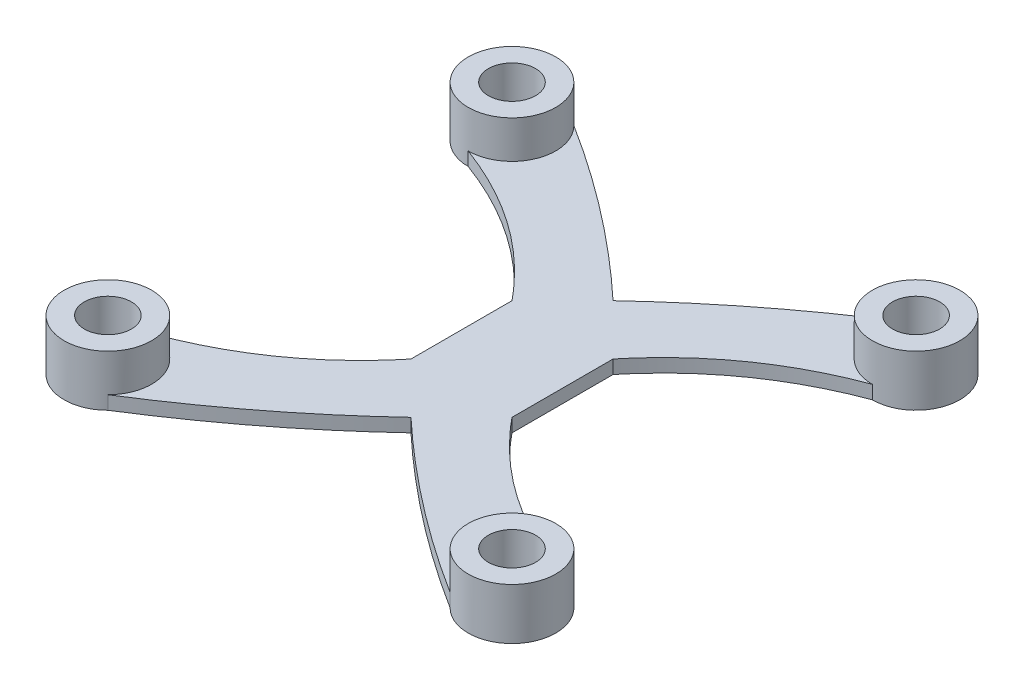
from build123d import *

# Parameters (mm, degrees)
SKETCH1_R           = 3.25
SKETCH1_R_2         = 1.75
SKETCH1_W           = 7.5
SKETCH1_H           = 7.5
BOSS_EXTRUDE1_DEPTH = 1
SKETCH2_R           = 3.25
SKETCH2_R_2         = 1.75
BOSS_EXTRUDE2_DEPTH = 2.8


with BuildPart() as part:
    # Sketch1 → Boss-Extrude1 (new body)
    # profile 1 of 11: a face of its own
    with BuildSketch(Plane(origin=(0, 0, 0), x_dir=(1, 0, 0), z_dir=(0, 1, 0))):
        with Locations((-15, -15)):
            Circle(SKETCH1_R)
        with Locations(Location((-15, -15, 0), (0, 0, 270))):
            Circle(SKETCH1_R_2, mode=Mode.SUBTRACT)
    # profile 2 of 11: a face of its own
    with BuildSketch(Plane(origin=(0, 0, 0), x_dir=(1, 0, 0), z_dir=(0, 1, 0))):
        with BuildLine():
            add(Edge.make_bspline(
                [(0, -7.5), (-1.930795648, -5.688459272), (-3.75, -3.75)],
                knots=[0.751545437, 0.751545437, 0.751545437, 1, 1, 1], degree=2))
            add(Edge.make_bspline(
                [(-15, -11.75), (-8.240801632, -9.240499337), (-3.75, -3.75)],
                knots=[0, 0, 0, 1, 1, 1], degree=2))
            ThreePointArc((-15, -11.75), (-12.701902961, -12.701902961), (-11.75, -15))
            ThreePointArc((-11.75, -15), (-11.997391519, -16.243721155), (-12.701902961, -17.298097039))
            add(Edge.make_bspline(
                [(-12.701902961, -17.298097039), (-5.840426668, -12.979694751), (0, -7.5)],
                knots=[0, 0, 0, 0.751545437, 0.751545437, 0.751545437], degree=2))
        make_face()
    # profile 3 of 11: a face of its own
    with BuildSketch(Plane(origin=(0, 0, 0), x_dir=(1, 0, 0), z_dir=(0, 1, 0))):
        with BuildLine():
            add(Edge.make_bspline(
                [(0, -7.5), (1.930795648, -5.688459272), (3.75, -3.75)],
                knots=[0.751545437, 0.751545437, 0.751545437, 1, 1, 1], degree=2))
            Line((3.75, -3.75), (-3.75, -3.75))
            add(Edge.make_bspline(
                [(0, -7.5), (-1.930795648, -5.688459272), (-3.75, -3.75)],
                knots=[0.751545437, 0.751545437, 0.751545437, 1, 1, 1], degree=2))
        make_face()
    # profile 4 of 11: a face of its own
    with BuildSketch(Plane(origin=(0, 0, 0), x_dir=(1, 0, 0), z_dir=(0, 1, 0))):
        Rectangle(SKETCH1_W, SKETCH1_H)
    # profile 5 of 11: a face of its own
    with BuildSketch(Plane(origin=(0, 0, 0), x_dir=(1, 0, 0), z_dir=(0, 1, 0))):
        with BuildLine():
            add(Edge.make_bspline(
                [(15, -11.75), (8.240801632, -9.240499337), (3.75, -3.75)],
                knots=[0, 0, 0, 1, 1, 1], degree=2))
            add(Edge.make_bspline(
                [(0, -7.5), (1.930795648, -5.688459272), (3.75, -3.75)],
                knots=[0.751545437, 0.751545437, 0.751545437, 1, 1, 1], degree=2))
            add(Edge.make_bspline(
                [(12.701902961, -17.298097039), (5.840426668, -12.979694751), (0, -7.5)],
                knots=[0, 0, 0, 0.751545437, 0.751545437, 0.751545437], degree=2))
            ThreePointArc((12.701902961, -17.298097039), (11.997391519, -13.756278845), (15, -11.75))
        make_face()
    # profile 6 of 11: a face of its own
    with BuildSketch(Plane(origin=(0, 0, 0), x_dir=(1, 0, 0), z_dir=(0, 1, 0))):
        with Locations((15, -15)):
            Circle(SKETCH1_R)
        with Locations(Location((15, -15, 0), (0, 0, 270))):
            Circle(SKETCH1_R_2, mode=Mode.SUBTRACT)
    # profile 7 of 11: a face of its own
    with BuildSketch(Plane(origin=(0, 0, 0), x_dir=(1, 0, 0), z_dir=(0, 1, 0))):
        with BuildLine():
            add(Edge.make_bspline(
                [(0, 7.5), (1.930795648, 5.688459272), (3.75, 3.75)],
                knots=[0.751545437, 0.751545437, 0.751545437, 1, 1, 1], degree=2))
            add(Edge.make_bspline(
                [(15, 11.75), (8.240801632, 9.240499337), (3.75, 3.75)],
                knots=[0, 0, 0, 1, 1, 1], degree=2))
            ThreePointArc((15, 11.75), (11.997391519, 13.756278845), (12.701902961, 17.298097039))
            add(Edge.make_bspline(
                [(12.701902961, 17.298097039), (5.840426668, 12.979694751), (0, 7.5)],
                knots=[0, 0, 0, 0.751545437, 0.751545437, 0.751545437], degree=2))
        make_face()
    # profile 8 of 11: a face of its own
    with BuildSketch(Plane(origin=(0, 0, 0), x_dir=(1, 0, 0), z_dir=(0, 1, 0))):
        with Locations((15, 15)):
            Circle(SKETCH1_R)
        with Locations(Location((15, 15, 0), (0, 0, 270))):
            Circle(SKETCH1_R_2, mode=Mode.SUBTRACT)
    # profile 9 of 11: a face of its own
    with BuildSketch(Plane(origin=(0, 0, 0), x_dir=(1, 0, 0), z_dir=(0, 1, 0))):
        with BuildLine():
            Line((-3.75, 3.75), (3.75, 3.75))
            add(Edge.make_bspline(
                [(0, 7.5), (1.930795648, 5.688459272), (3.75, 3.75)],
                knots=[0.751545437, 0.751545437, 0.751545437, 1, 1, 1], degree=2))
            add(Edge.make_bspline(
                [(0, 7.5), (-1.930795648, 5.688459272), (-3.75, 3.75)],
                knots=[0.751545437, 0.751545437, 0.751545437, 1, 1, 1], degree=2))
        make_face()
    # profile 10 of 11: a face of its own
    with BuildSketch(Plane(origin=(0, 0, 0), x_dir=(1, 0, 0), z_dir=(0, 1, 0))):
        with BuildLine():
            add(Edge.make_bspline(
                [(-15, 11.75), (-8.240801632, 9.240499337), (-3.75, 3.75)],
                knots=[0, 0, 0, 1, 1, 1], degree=2))
            add(Edge.make_bspline(
                [(0, 7.5), (-1.930795648, 5.688459272), (-3.75, 3.75)],
                knots=[0.751545437, 0.751545437, 0.751545437, 1, 1, 1], degree=2))
            add(Edge.make_bspline(
                [(-12.701902961, 17.298097039), (-5.840426668, 12.979694751), (0, 7.5)],
                knots=[0, 0, 0, 0.751545437, 0.751545437, 0.751545437], degree=2))
            ThreePointArc((-12.701902961, 17.298097039), (-11.997391519, 16.243721155), (-11.75, 15))
            ThreePointArc((-11.75, 15), (-12.701902961, 12.701902961), (-15, 11.75))
        make_face()
    # profile 11 of 11: a face of its own
    with BuildSketch(Plane(origin=(0, 0, 0), x_dir=(1, 0, 0), z_dir=(0, 1, 0))):
        with Locations((-15, 15)):
            Circle(SKETCH1_R)
        with Locations(Location((-15, 15, 0), (0, 0, 270))):
            Circle(SKETCH1_R_2, mode=Mode.SUBTRACT)
    extrude(amount=BOSS_EXTRUDE1_DEPTH)

    # Sketch2 → Boss-Extrude2 (add)
    # profile 1 of 4: a face of its own
    with BuildSketch(Plane(origin=(0, 1, 0), x_dir=(1, 0, 0), z_dir=(0, 1, 0))):
        with Locations(Location((-15, 15, 0), (0, 0, 270))):
            Circle(SKETCH2_R)
        with Locations(Location((-15, 15, 0), (0, 0, 270))):
            Circle(SKETCH2_R_2, mode=Mode.SUBTRACT)
    # profile 2 of 4: a face of its own
    with BuildSketch(Plane(origin=(0, 1, 0), x_dir=(1, 0, 0), z_dir=(0, 1, 0))):
        with Locations(Location((15, 15, 0), (0, 0, 270))):
            Circle(SKETCH2_R)
        with Locations(Location((15, 15, 0), (0, 0, 270))):
            Circle(SKETCH2_R_2, mode=Mode.SUBTRACT)
    # profile 3 of 4: a face of its own
    with BuildSketch(Plane(origin=(0, 1, 0), x_dir=(1, 0, 0), z_dir=(0, 1, 0))):
        with Locations(Location((15, -15, 0), (0, 0, 90))):
            Circle(SKETCH2_R)
        with Locations(Location((15, -15, 0), (0, 0, 270))):
            Circle(SKETCH2_R_2, mode=Mode.SUBTRACT)
    # profile 4 of 4: a face of its own
    with BuildSketch(Plane(origin=(0, 1, 0), x_dir=(1, 0, 0), z_dir=(0, 1, 0))):
        with Locations(Location((-15, -15, 0), (0, 0, 90))):
            Circle(SKETCH2_R)
        with Locations(Location((-15, -15, 0), (0, 0, 270))):
            Circle(SKETCH2_R_2, mode=Mode.SUBTRACT)
    extrude(amount=BOSS_EXTRUDE2_DEPTH)


solid = part.part
